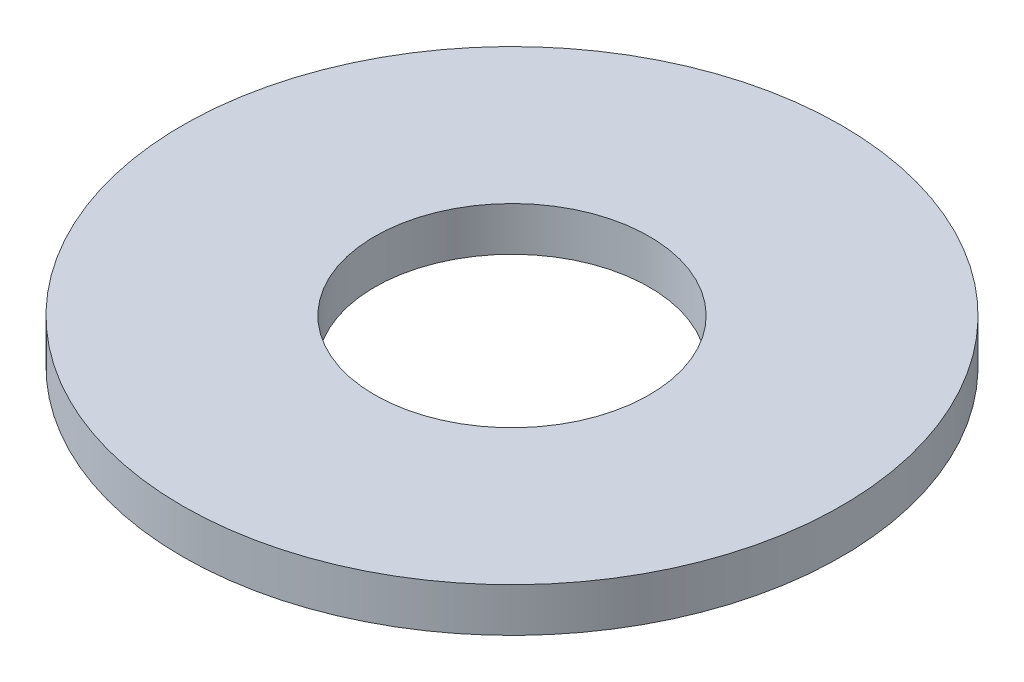
from build123d import *

# Parameters (mm, degrees)
SKETCH1_R           = 19.05
SKETCH1_R_2         = 7.9375
BOSS_EXTRUDE1_DEPTH = 2.54


with BuildPart() as part:
    # Sketch1 → Boss-Extrude1 (new body)
    with BuildSketch(Plane(origin=(0, 0, 0), x_dir=(1, 0, 0), z_dir=(0, 1, 0))):
        with Locations(Location((0, 0, 0), (0, 0, 270))):
            Circle(SKETCH1_R)
        with Locations(Location((0, 0, 0), (0, 0, 270))):
            Circle(SKETCH1_R_2, mode=Mode.SUBTRACT)
    extrude(amount=BOSS_EXTRUDE1_DEPTH)


solid = part.part
